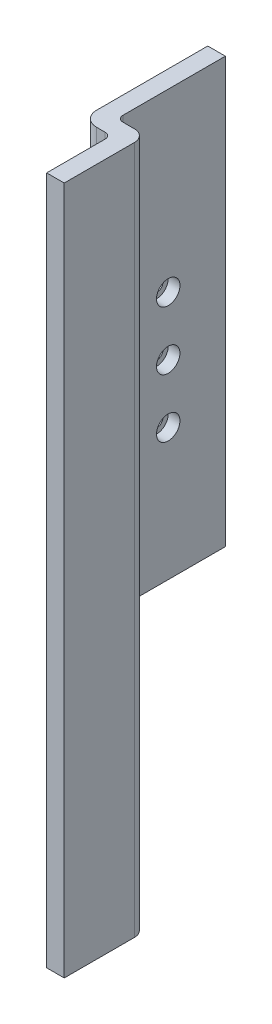
from build123d import *

# Parameters (mm, degrees)
SCHIZZO1_W                                           = 235
SCHIZZO1_H                                           = 65
ESTRUSIONE_ESTRUSIONE1_DEPTH                         = 16
SCHIZZO2_W                                           = 10
SCHIZZO2_H                                           = 37
TAGLIO_ESTRUSIONE1_DEPTH                             = 240.436839271
SCHIZZO3_W                                           = 35
SCHIZZO3_H                                           = 90
TAGLIO_ESTRUSIONE2_DEPTH                             = 240.436839271
SCHIZZO4_W                                           = 10
SCHIZZO4_H                                           = 22
TAGLIO_ESTRUSIONE3_DEPTH                             = 240.436839271
FORO_LAMATO_PER_VITE_M4_A_TESTA_ESAGONAL_D           = 4.5
FORO_LAMATO_PER_VITE_M4_A_TESTA_ESAGONAL_CBORE_D     = 8
FORO_LAMATO_PER_VITE_M4_A_TESTA_ESAGONAL_CBORE_DEPTH = 4
RACCORDO1_R                                          = 2
RACCORDO2_R                                          = 4
RACCORDO3_R                                          = 5
RACCORDO4_R                                          = 6


with BuildPart() as part:
    # Schizzo1 → Estrusione-Estrusione1 (new body)
    with BuildSketch(Plane(origin=(0, 0, 0), x_dir=(0, -1, 0), z_dir=(-1, 0, 0))):
        with Locations((-117.5, -10.5)):
            Rectangle(SCHIZZO1_W, SCHIZZO1_H)
    extrude(amount=-ESTRUSIONE_ESTRUSIONE1_DEPTH)

    # Schizzo2 → Taglio-Estrusione1 (cut, through all)
    with BuildSketch(Plane.XZ):
        with Locations((11, -24.5)):
            Rectangle(SCHIZZO2_W, SCHIZZO2_H)
    extrude(amount=-TAGLIO_ESTRUSIONE1_DEPTH, mode=Mode.SUBTRACT)

    # Schizzo3 → Taglio-Estrusione2 (cut, through all)
    with BuildSketch(Plane.ZY):
        with Locations((-25.5, 45)):
            Rectangle(SCHIZZO3_W, SCHIZZO3_H)
    extrude(amount=-TAGLIO_ESTRUSIONE2_DEPTH, mode=Mode.SUBTRACT)

    # Schizzo4 → Taglio-Estrusione3 (cut, through all)
    with BuildSketch(Plane.XZ):
        with Locations((5, 11)):
            Rectangle(SCHIZZO4_W, SCHIZZO4_H)
    extrude(amount=-TAGLIO_ESTRUSIONE3_DEPTH, mode=Mode.SUBTRACT)

    # Foro lamato per Vite M4 a testa esagonale-1 (through all)
    with Locations(Plane(origin=(6, 0, 0), x_dir=(0, 0, -1), z_dir=(1, 0, 0))):
        with Locations((23.5, 175), (23.5, 155), (23.5, 135)):
            CounterBoreHole(FORO_LAMATO_PER_VITE_M4_A_TESTA_ESAGONAL_D / 2, FORO_LAMATO_PER_VITE_M4_A_TESTA_ESAGONAL_CBORE_D / 2, FORO_LAMATO_PER_VITE_M4_A_TESTA_ESAGONAL_CBORE_DEPTH)

    # Raccordo1
    raccordo1_edges = [part.edges().sort_by_distance(p)[0] for p in [
        (10, 117.5, 0),
        (6, 117.5, -6),
    ]]
    fillet(raccordo1_edges, radius=RACCORDO1_R)

    # Raccordo2
    raccordo2_edges = [part.edges().sort_by_distance(p)[0] for p in [
        (16, 117.5, -6),
    ]]
    fillet(raccordo2_edges, radius=RACCORDO2_R)

    # Raccordo3
    raccordo3_edges = [part.edges().sort_by_distance(p)[0] for p in [
        (0, 117.5, 0),
    ]]
    fillet(raccordo3_edges, radius=RACCORDO3_R)

    # Raccordo4
    raccordo4_edges = [part.edges().sort_by_distance(p)[0] for p in [
        (3, 90, -8),
    ]]
    fillet(raccordo4_edges, radius=RACCORDO4_R)


solid = part.part
